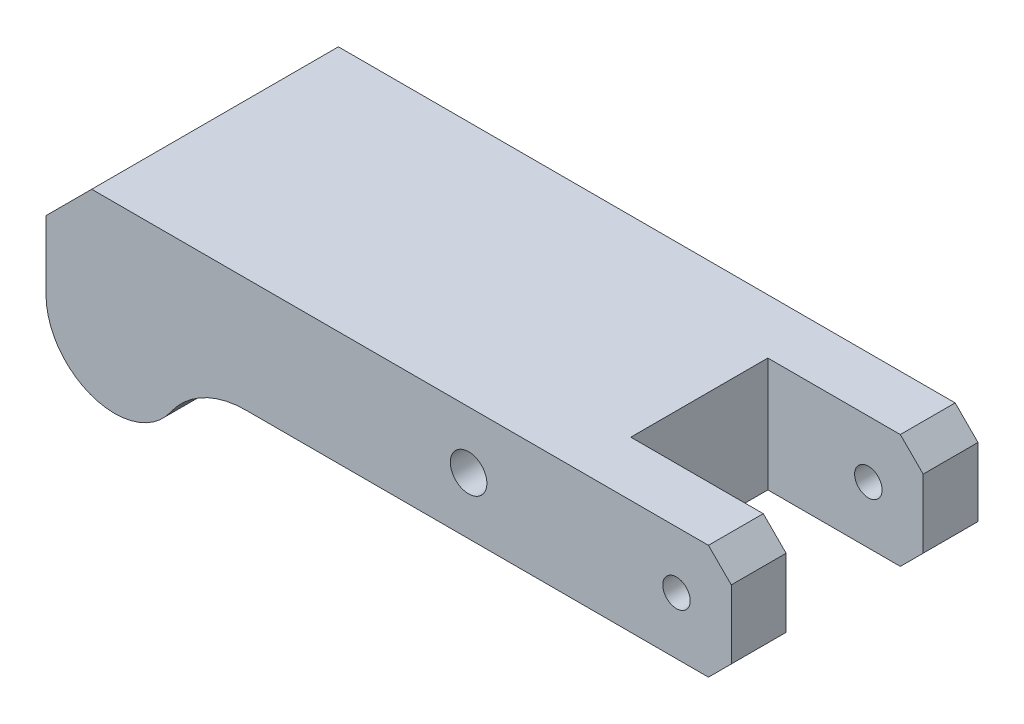
from build123d import *

# Parameters (mm, degrees)
BOSS_EXTRUDE1_DEPTH = 54
SKETCH2_W           = 34
SKETCH2_H           = 30
CUT_EXTRUDE1_DEPTH  = 54
SKETCH3_R           = 3
SKETCH3_R_2         = 4
CUT_EXTRUDE2_DEPTH  = 54


with BuildPart() as part:
    # Sketch1 → Boss-Extrude1 (new body)
    with BuildSketch(Plane.XY):
        with BuildLine():
            Line((-15, 0), (-15, 15))
            Line((-15, 15), (-5, 25))
            Line((-5, 25), (130, 25))
            Line((130, 25), (135, 20))
            Line((135, 20), (135, 5))
            Line((135, 5), (130, 0))
            Line((130, 0), (28.722813233, 0))
            ThreePointArc((28.722813233, 0), (19.464612235, -2.271894791), (12.3097771, -8.571428571))
            ThreePointArc((12.3097771, -8.571428571), (-4.491845028, -14.311650088), (-15, 0))
        make_face()
    extrude(amount=-BOSS_EXTRUDE1_DEPTH)

    # Sketch2 → Cut-Extrude1 (cut)
    with BuildSketch(Plane(origin=(0, 25, 0), x_dir=(1, 0, 0), z_dir=(0, 1, 0))):
        with Locations((118, 27)):
            Rectangle(SKETCH2_W, SKETCH2_H)
    extrude(amount=-CUT_EXTRUDE1_DEPTH, mode=Mode.SUBTRACT)

    # Sketch3 → Cut-Extrude2 (cut)
    with BuildSketch(Plane.XY):
        with Locations((123, 12.5)):
            Circle(SKETCH3_R)
        with Locations((77.5, 12.5)):
            Circle(SKETCH3_R_2)
    extrude(amount=-CUT_EXTRUDE2_DEPTH, mode=Mode.SUBTRACT)


solid = part.part
